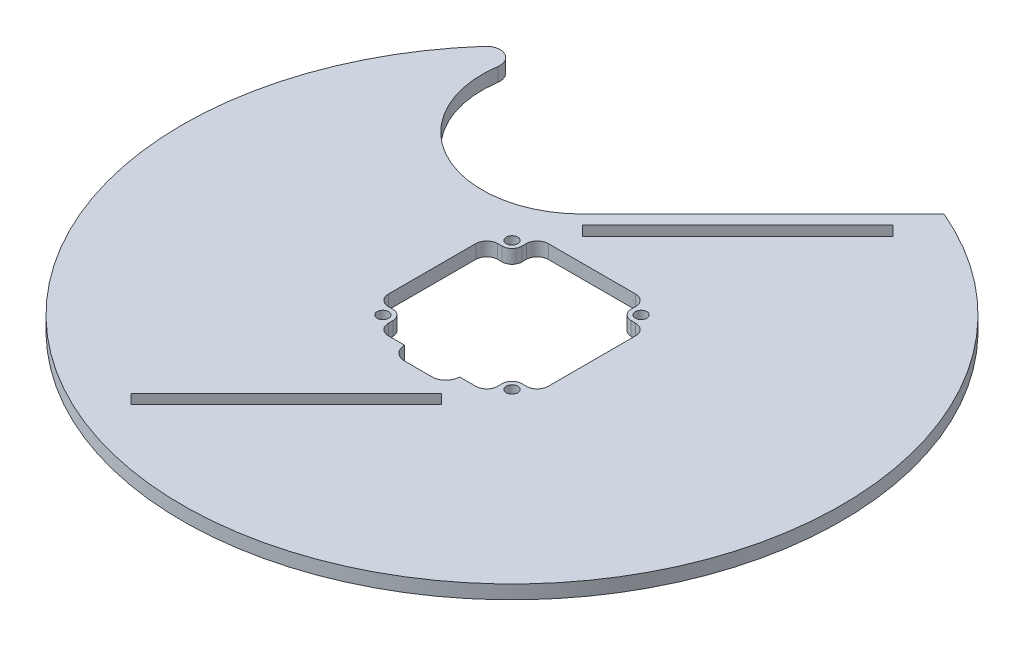
from build123d import *

# Parameters (mm, degrees)
EXTRUDE_1_DEPTH          = 5
CUT_EXTRUDE_1_DEPTH      = 170.779268463
CUT_EXTRUDE_1_DEPTH_BACK = 170.779268463
HOLE_WIZARD_M5_1_D       = 4.2


with BuildPart() as part:
    # 草圖1 → 填料-伸長1 (new body)
    with BuildSketch(Plane(origin=(0, 0, 0), x_dir=(1, 0, 0), z_dir=(0, 1, 0))):
        with BuildLine():
            Line((46.840858459, 110.480468766), (-18.994949366, 44.644660941))
            ThreePointArc((-18.994949366, 44.644660941), (-61.199118411, 37.840868245), (-80.9211148, 75.768777998))
            ThreePointArc((-80.9211148, 75.768777998), (-83.752223837, 81.026793285), (-89.60126665, 79.822384171))
            ThreePointArc((-89.60126665, 79.822384171), (26.307654113, -117.080772696), (46.840858459, 110.480468766))
        make_face()
        Polygon((-41.109127035, -97.67766953), (-44.644660941, -94.142135624), (11.923881554, -37.573593129), (15.45941546, -41.109127035), align=None, mode=Mode.SUBTRACT)
        with BuildLine():
            ThreePointArc((-23.499999452, 19.89891353), (-20.953647337, 20.953647337), (-19.89891353, 23.499999452))
            Line((-19.89891353, 23.499999452), (-19.898913286, 25.100000259))
            ThreePointArc((-19.898913286, 25.100000259), (-18.727340196, 27.92842699), (-15.898913286, 29.09999965))
            Line((-15.898913286, 29.09999965), (15.898913286, 29.09999965))
            ThreePointArc((15.898913286, 29.09999965), (18.727340196, 27.92842699), (19.898913286, 25.100000259))
            Line((19.898913286, 25.100000259), (19.89891353, 23.499999452))
            ThreePointArc((19.89891353, 23.499999452), (20.953647337, 20.953647337), (23.499999452, 19.89891353))
            Line((23.499999452, 19.89891353), (25.100000259, 19.898913286))
            ThreePointArc((25.100000259, 19.898913286), (27.92842699, 18.727340196), (29.09999965, 15.898913286))
            Line((29.09999965, 15.898913286), (29.09999965, -15.898913286))
            ThreePointArc((29.09999965, -15.898913286), (27.92842699, -18.727340196), (25.100000259, -19.898913286))
            Line((25.100000259, -19.898913286), (23.499999452, -19.89891353))
            ThreePointArc((23.499999452, -19.89891353), (20.953647337, -20.953647337), (19.89891353, -23.499999452))
            Line((19.89891353, -23.499999452), (19.898913286, -25.100000259))
            ThreePointArc((19.898913286, -25.100000259), (18.727340196, -27.92842699), (15.898913286, -29.09999965))
            Line((15.898913286, -29.09999965), (-15.898913286, -29.09999965))
            ThreePointArc((-15.898913286, -29.09999965), (-18.727340196, -27.92842699), (-19.898913286, -25.100000259))
            Line((-19.898913286, -25.100000259), (-19.89891353, -23.499999452))
            ThreePointArc((-19.89891353, -23.499999452), (-20.953647337, -20.953647337), (-23.499999452, -19.89891353))
            Line((-23.499999452, -19.89891353), (-25.100000259, -19.898913286))
            ThreePointArc((-25.100000259, -19.898913286), (-27.92842699, -18.727340196), (-29.09999965, -15.898913286))
            Line((-29.09999965, -15.898913286), (-29.09999965, 15.898913286))
            ThreePointArc((-29.09999965, 15.898913286), (-27.92842699, 18.727340196), (-25.100000259, 19.898913286))
            Line((-25.100000259, 19.898913286), (-23.499999452, 19.89891353))
        make_face(mode=Mode.SUBTRACT)
        Polygon((44.644660941, 94.142135624), (-11.923881554, 37.573593129), (-15.45941546, 41.109127035), (41.109127035, 97.67766953), align=None, mode=Mode.SUBTRACT)
    extrude(amount=-EXTRUDE_1_DEPTH)

    # 草圖5 → 除料-伸長1 (cut, two sides: drawn at the far end of the back side and taken through both)
    with BuildSketch(Plane(origin=(0, 0, 0), x_dir=(1, 0, 0), z_dir=(0, 1, 0)).offset(-CUT_EXTRUDE_1_DEPTH_BACK)):
        with BuildLine():
            Line((-5, -24.09999965), (5, -24.09999965))
            ThreePointArc((5, -24.09999965), (10, -29.09999965), (5, -34.09999965))
            Line((5, -34.09999965), (-5, -34.09999965))
            ThreePointArc((-5, -34.09999965), (-10, -29.09999965), (-5, -24.09999965))
        make_face()
    extrude(amount=CUT_EXTRUDE_1_DEPTH + CUT_EXTRUDE_1_DEPTH_BACK, mode=Mode.SUBTRACT)

    # M5 螺紋孔1 (through all)
    with Locations(Plane(origin=(0, 0, 0), x_dir=(1, 0, 0), z_dir=(0, 1, 0))):
        with Locations((23.5, 23.5), (23.5, -23.5), (-23.5, -23.5), (-23.5, 23.5)):
            Hole(HOLE_WIZARD_M5_1_D / 2)


solid = part.part
